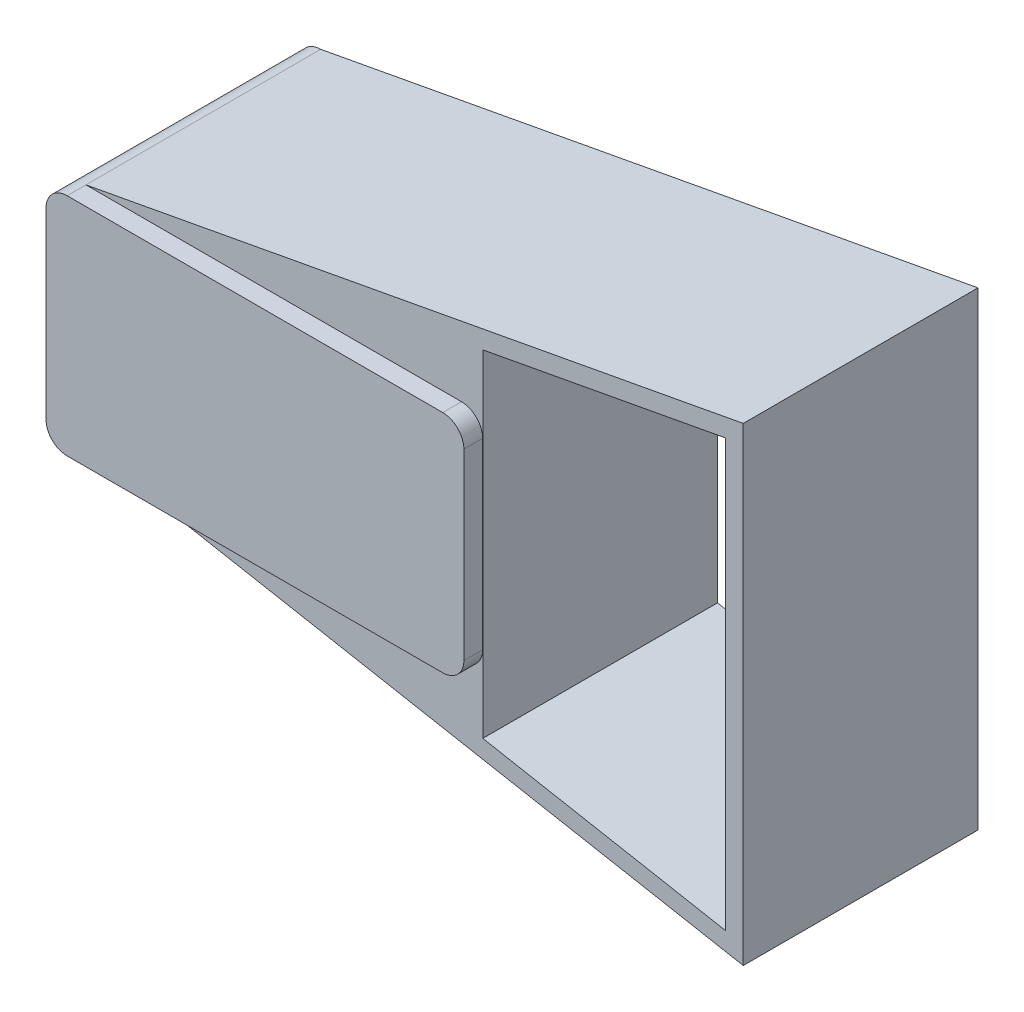
from build123d import *

# Parameters (mm, degrees)
BOSS_EXTRU_1_DEPTH      = 2
BOSS_EXTRU_3_START      = 25
BOSS_EXTRU_3_DEPTH      = 25
ENL_V_MAT_EXTRU_1_DEPTH = 50


with BuildPart() as part:
    # Esquisse1 → Boss.-Extru.1 (new body)
    with BuildSketch(Plane.XY):
        with BuildLine():
            Line((20, 2), (-20, 2))
            ThreePointArc((-20, 2), (-21.590990258, 1.340990258), (-22.25, -0.25))
            Line((-22.25, -0.25), (-22.25, -19.75))
            ThreePointArc((-22.25, -19.75), (-21.590990258, -21.340990258), (-20, -22))
            Line((-20, -22), (20, -22))
            ThreePointArc((20, -22), (21.590990258, -21.340990258), (22.25, -19.75))
            Line((22.25, -19.75), (22.25, -0.25))
            ThreePointArc((22.25, -0.25), (21.590990258, 1.340990258), (20, 2))
        make_face()
    extrude(amount=BOSS_EXTRU_1_DEPTH)

    # Esquisse2 → Boss.-Extru.3 (add)
    # profile 1 of 2: a face of its own
    with BuildSketch(Plane(origin=(0, 0, 0), x_dir=(-1, 0, 0), z_dir=(0, 0, -1)).offset(BOSS_EXTRU_3_START)):
        with BuildLine():
            Line((-22.25, -19.75), (-22.25, -0.25))
            ThreePointArc((-22.25, -0.25), (-21.590990258, 1.340990258), (-20, 2))
            Line((-20, 2), (20, 2))
            Line((20, 2), (-50, 15))
            Line((-50, 15), (-50, 2))
            Line((-50, 2), (-50, -22))
            Line((-50, -22), (-50, -35))
            Line((-50, -35), (20, -22))
            Line((20, -22), (-20, -22))
            ThreePointArc((-20, -22), (-21.590990258, -21.340990258), (-22.25, -19.75))
        make_face()
    # profile 2 of 2: a face of its own
    with BuildSketch(Plane(origin=(0, 0, 0), x_dir=(-1, 0, 0), z_dir=(0, 0, -1)).offset(BOSS_EXTRU_3_START)):
        with BuildLine():
            Line((20, 2), (-20, 2))
            ThreePointArc((-20, 2), (-21.590990258, 1.340990258), (-22.25, -0.25))
            Line((-22.25, -0.25), (-22.25, -19.75))
            ThreePointArc((-22.25, -19.75), (-21.590990258, -21.340990258), (-20, -22))
            Line((-20, -22), (20, -22))
            ThreePointArc((20, -22), (21.590990258, -21.340990258), (22.25, -19.75))
            Line((22.25, -19.75), (22.25, -0.25))
            ThreePointArc((22.25, -0.25), (21.590990258, 1.340990258), (20, 2))
        make_face()
        with BuildLine():
            ThreePointArc((20.35, -0.25), (20.247487373, -0.002512627), (20, 0.1))
            Line((20, 0.1), (-20, 0.1))
            ThreePointArc((-20, 0.1), (-20.247487373, -0.002512627), (-20.35, -0.25))
            Line((-20.35, -0.25), (-20.35, -19.75))
            ThreePointArc((-20.35, -19.75), (-20.247487373, -19.997487373), (-20, -20.1))
            Line((-20, -20.1), (20, -20.1))
            ThreePointArc((20, -20.1), (20.247487373, -19.997487373), (20.35, -19.75))
            Line((20.35, -19.75), (20.35, -0.25))
        make_face(mode=Mode.SUBTRACT)
    extrude(amount=-BOSS_EXTRU_3_DEPTH)

    # Esquisse5 → Enlèv. mat.-Extru.1 (cut)
    with BuildSketch(Plane(origin=(0, 0, -25), x_dir=(-1, 0, 0), z_dir=(0, 0, -1))):
        Polygon((-22.26420213, 7.916578551), (-48.1, 12.714655299), (-48.1, -32.714655299), (-22.26420213, -27.916578551), align=None)
    extrude(amount=-ENL_V_MAT_EXTRU_1_DEPTH, mode=Mode.SUBTRACT)


solid = part.part
